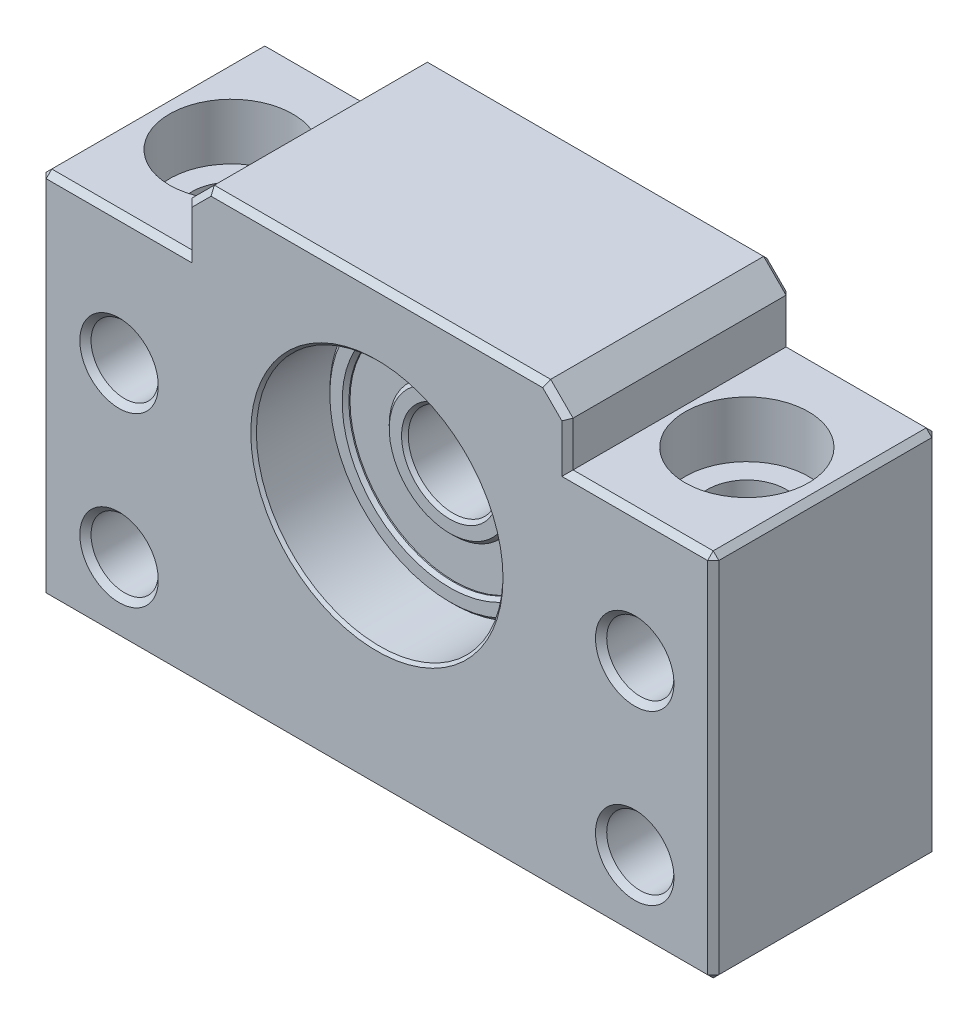
from build123d import *

# Parameters (mm, degrees)
BOSS_EXTRUDE1_DEPTH             = 10
BOSS_EXTRUDE1_DEPTH_BACK        = 10
CHAMFER1_SIZE                   = 2
HOLE_6MM_MOUNT_FRONT_AT_2_COUNT = 2
HOLE_6MM_MOUNT_FRONT_AT_2_PITCH = 15
HOLE_6MM_MOUNT_FRONT_AT_3_COUNT = 2
HOLE_6MM_MOUNT_FRONT_AT_3_PITCH = 48.383881614
HOLE_6MM_MOUNT_FRONT_AT_4_COUNT = 2
HOLE_6MM_MOUNT_FRONT_AT_4_PITCH = 46
HOLES_CAP_AT_2_COUNT            = 2
HOLES_CAP_AT_2_PITCH            = 46
CHAMFER4_SIZE                   = 0.3
CHAMFER6_SIZE                   = 0.5


with BuildPart() as part:
    # Sketch1 → Boss-Extrude1 (new, two sides: drawn at the far end of the back side and taken through both)
    with BuildSketch(Plane.XY.offset(-BOSS_EXTRUDE1_DEPTH_BACK)):
        Polygon((-17, 17), (17, 17), (17, 11), (30, 11), (30, -22), (-30, -22), (-30, 11), (-17, 11), align=None)
    extrude(amount=BOSS_EXTRUDE1_DEPTH + BOSS_EXTRUDE1_DEPTH_BACK)

    # Chamfer1
    chamfer1_edges = [part.edges().sort_by_distance(p)[0] for p in [
        (-17, 17, 0),
        (17, 17, 0),
    ]]
    chamfer(chamfer1_edges, length=CHAMFER1_SIZE)

    # Sketch6 → hole 22mm bearing (revolve, cut)
    with BuildSketch(Plane(origin=(0, 0, -10), x_dir=(0, 1, 0), z_dir=(1, 0, 0))):
        Polygon((0, 0), (0, 20), (11.25, 20), (11, 19.75), (11, 0.25), (11.25, 0), align=None)
    revolve(axis=Axis((0, 0, -16.35), (0, 0, 1)), mode=Mode.SUBTRACT)

    # Sketch7 → hole 6mm mount front (revolve, cut)
    with BuildSketch(Plane(origin=(23, -0.5, -10), x_dir=(0, 1, 0), z_dir=(1, 0, 0))):
        Polygon((0, 0), (0, 20), (3.5, 20), (3, 19.5), (3, 0.5), (3.5, 0), align=None)
    hole_6mm_mount_front = revolve(axis=Axis((23, -0.5, -16.35), (0, 0, 1)), mode=Mode.SUBTRACT)

    # hole 6mm mount front at 2: hole 6mm mount front ×2
    with Locations(*[(0, -i * HOLE_6MM_MOUNT_FRONT_AT_2_PITCH, 0) for i in range(1, HOLE_6MM_MOUNT_FRONT_AT_2_COUNT)]):
        add(hole_6mm_mount_front, mode=Mode.SUBTRACT)

    # hole 6mm mount front at 3: hole 6mm mount front ×2
    with Locations(*[Vector(-0.9507298394814788, -0.31002059983091684, 0) * (i * HOLE_6MM_MOUNT_FRONT_AT_3_PITCH) for i in range(1, HOLE_6MM_MOUNT_FRONT_AT_3_COUNT)]):
        add(hole_6mm_mount_front, mode=Mode.SUBTRACT)

    # hole 6mm mount front at 4: hole 6mm mount front ×2
    with Locations(*[(-i * HOLE_6MM_MOUNT_FRONT_AT_4_PITCH, 0, 0) for i in range(1, HOLE_6MM_MOUNT_FRONT_AT_4_COUNT)]):
        add(hole_6mm_mount_front, mode=Mode.SUBTRACT)

    # Sketch11 → holes cap (revolve, cut)
    with BuildSketch(Plane(origin=(23, 11, 0), x_dir=(0, 0, 1), z_dir=(1, 0, 0))):
        Polygon((0, 0), (0, 33), (4, 33), (3.5, 32.5), (3.5, 5), (5.5, 5), (5.5, 0), align=None)
    holes_cap = revolve(axis=Axis((23, 17.35, 0), (0, -1, 0)), mode=Mode.SUBTRACT)

    # holes cap at 2: holes cap ×2
    with Locations(*[(-i * HOLES_CAP_AT_2_PITCH, 0, 0) for i in range(1, HOLES_CAP_AT_2_COUNT)]):
        add(holes_cap, mode=Mode.SUBTRACT)

    # Chamfer6
    chamfer6_edges = [part.edges().sort_by_distance(p)[0] for p in [
        (-30, -5.5, -10),
        (0, -22, -10),
        (30, 11, 0),
        (30, -22, 0),
        (-30, -22, 0),
        (-30, 11, 0),
        (30, -5.5, -10),
        (23.5, 11, -10),
        (17, 13, -10),
        (-23.5, 11, 10),
        (-30, -5.5, 10),
        (0, -22, 10),
        (30, -5.5, 10),
        (23.5, 11, 10),
        (17, 13, 10),
        (0, 17, 10),
        (0, 17, -10),
        (-17, 13, 10),
        (16, 16, 10),
        (-16, 16, 10),
        (-17, 13, -10),
        (16, 16, -10),
        (-16, 16, -10),
        (-23.5, 11, -10),
    ]]
    chamfer(chamfer6_edges, length=CHAMFER6_SIZE)


with BuildPart() as body_2:
    # Sketch17 → Revolve2 (revolve)
    with BuildSketch(Plane(origin=(0, 0, 0), x_dir=(1, 0, 0), z_dir=(0, 1, 0))):
        Polygon((-5.7, 3.5), (-4, 3.5), (-4, -3.5), (-5.7, -3.5), (-5.7, -3.1), (-9.3, -3.1), (-9.3, -3.5), (-11, -3.5), (-11, 3.5), (-9.3, 3.5), (-9.3, 3.1), (-5.7, 3.1), align=None)
    revolve(axis=Axis((0, 0, -10), (0, 0, 1)))

    # Chamfer4
    chamfer4_edges = [body_2.edges().sort_by_distance(p)[0] for p in [
        (9.3, 0, 3.5),
        (11, 0, 3.5),
        (5.7, 0, -3.5),
        (4, 0, -3.5),
        (4, 0, 3.5),
        (5.7, 0, 3.5),
    ]]
    chamfer(chamfer4_edges, length=CHAMFER4_SIZE)


solid = Compound([part.part, body_2.part])
